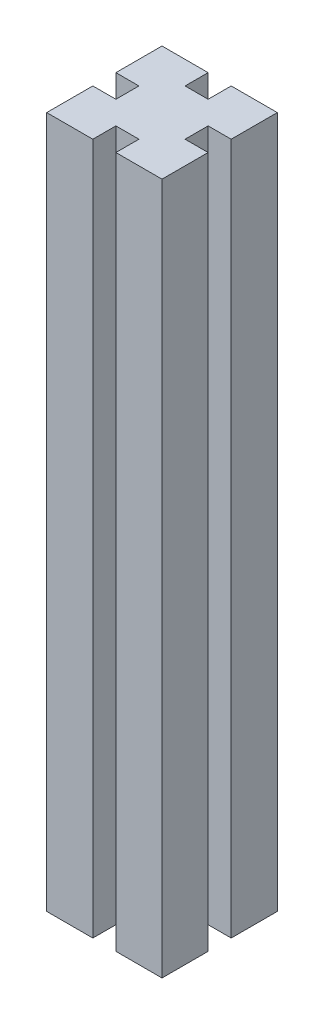
from build123d import *

# Parameters (mm, degrees)
SKIZZE1_W                       = 25
SKIZZE1_H                       = 25
AUFSATZ_LINEAR_AUSTRAGEN1_DEPTH = 150
SKIZZE2_W                       = 5
SKIZZE2_H                       = 10
SKIZZE2_W_2                     = 10
SKIZZE2_H_2                     = 5
SCHNITT_LINEAR_AUSTRAGEN1_DEPTH = 150


with BuildPart() as part:
    # Skizze1 → Aufsatz-Linear austragen1 (new body)
    with BuildSketch(Plane(origin=(0, 0, 0), x_dir=(1, 0, 0), z_dir=(0, 1, 0))):
        Rectangle(SKIZZE1_W, SKIZZE1_H)
    extrude(amount=AUFSATZ_LINEAR_AUSTRAGEN1_DEPTH)

    # Skizze2 → Schnitt-Linear austragen1 (cut)
    with BuildSketch(Plane(origin=(0, 150, 0), x_dir=(1, 0, 0), z_dir=(0, 1, 0))):
        with Locations((0, 12.5)):
            Rectangle(SKIZZE2_W, SKIZZE2_H)
        with Locations((12.5, 0)):
            Rectangle(SKIZZE2_W_2, SKIZZE2_H_2)
        with Locations((0, -12.5)):
            Rectangle(SKIZZE2_W, SKIZZE2_H)
        with Locations((-12.5, 0)):
            Rectangle(SKIZZE2_W_2, SKIZZE2_H_2)
    extrude(amount=-SCHNITT_LINEAR_AUSTRAGEN1_DEPTH, mode=Mode.SUBTRACT)


solid = part.part
